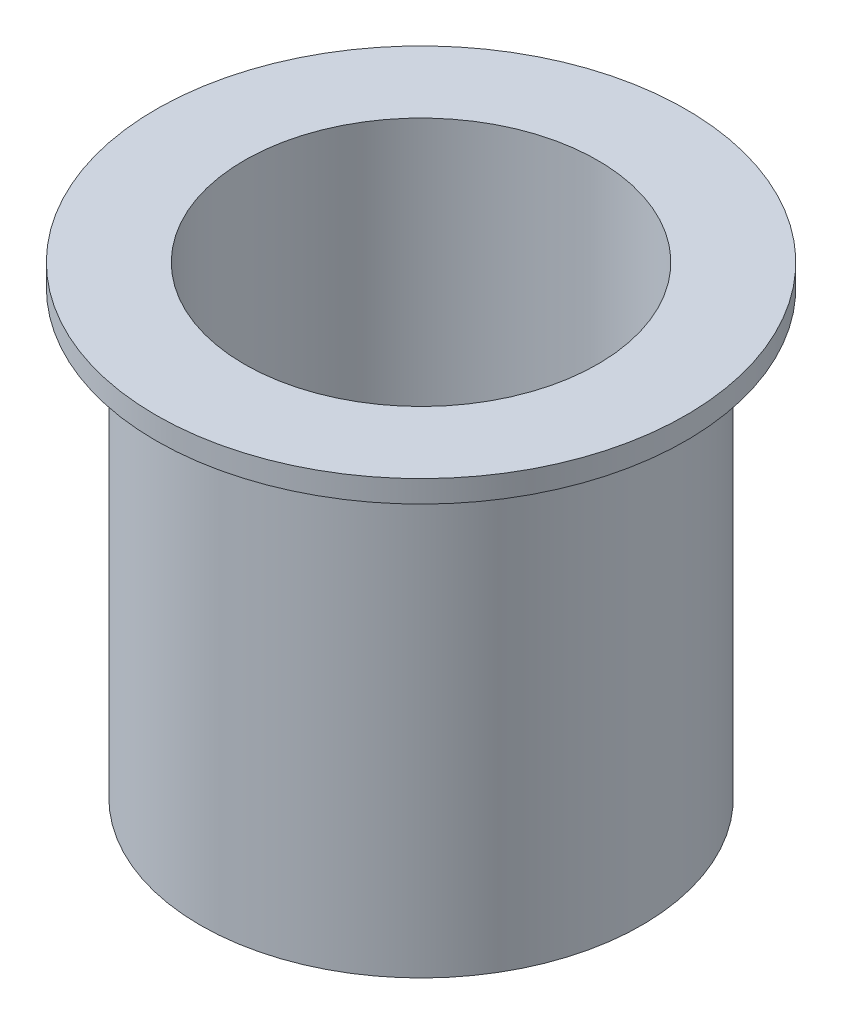
from build123d import *

# Parameters (mm, degrees)
SKETCH2_R           = 10
SKETCH2_R_2         = 8
BOSS_EXTRUDE1_DEPTH = 20
BOSS_EXTRUDE2_START = 1
SKETCH3_R           = 12
SKETCH3_R_2         = 8
BOSS_EXTRUDE2_DEPTH = 1


with BuildPart() as part:
    # Sketch2 → Boss-Extrude1 (new body)
    with BuildSketch(Plane(origin=(0, 0, 0), x_dir=(1, 0, 0), z_dir=(0, 1, 0))):
        with Locations(Location((0, 0, 0), (0, 0, 270))):
            Circle(SKETCH2_R)
        with Locations(Location((0, 0, 0), (0, 0, 270))):
            Circle(SKETCH2_R_2, mode=Mode.SUBTRACT)
    extrude(amount=-BOSS_EXTRUDE1_DEPTH)

    # Sketch3 → Boss-Extrude2 (add)
    with BuildSketch(Plane(origin=(0, 0, 0), x_dir=(1, 0, 0), z_dir=(0, 1, 0)).offset(BOSS_EXTRUDE2_START)):
        with Locations(Location((0, 0, 0), (0, 0, 270))):
            Circle(SKETCH3_R)
        with Locations(Location((0, 0, 0), (0, 0, 270))):
            Circle(SKETCH3_R_2, mode=Mode.SUBTRACT)
    extrude(amount=-BOSS_EXTRUDE2_DEPTH)


solid = part.part
